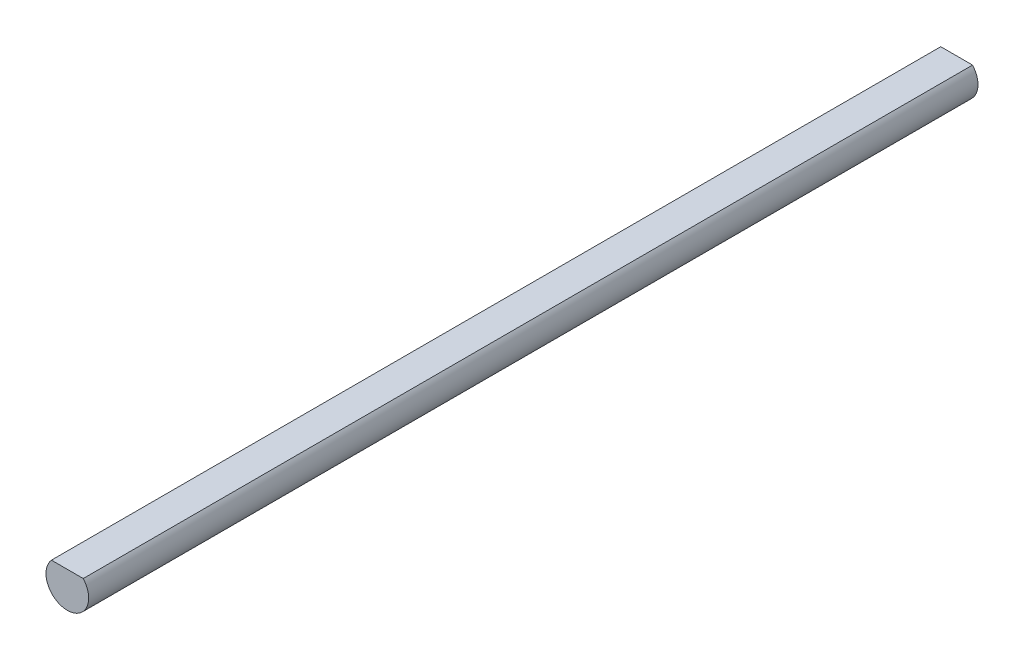
from build123d import *

# Parameters (mm, degrees)
SKETCH_1_W               = 125
SKETCH_1_H               = 3
CUT_EXTRUDE_1_DEPTH      = 63.643834493
CUT_EXTRUDE_1_DEPTH_BACK = 63.643834493
SKETCH_3_W               = 11.840495881
SKETCH_3_H               = 1.897947672


with BuildPart() as part:
    # 草圖1 → 旋轉1 (revolve)
    with BuildSketch(Plane(origin=(0, 0, 0), x_dir=(0, 0, -1), z_dir=(1, 0, 0)), mode=Mode.PRIVATE) as revolve_1_sk:
        with Locations((0, 1.5)):
            Rectangle(SKETCH_1_W, SKETCH_1_H)
    revolve(revolve_1_sk.sketch.rotate(Axis((0, 0, 62.5), (0, 0, -1)), 180), axis=Axis((0, 0, 62.5), (0, 0, -1)))

    # 草圖3 → 除料-伸長1 (cut, two sides: drawn at the far end of the back side and taken through both)
    with BuildSketch(Plane.XY.offset(-CUT_EXTRUDE_1_DEPTH_BACK)):
        with Locations((0.505798237, 2.948973836)):
            Rectangle(SKETCH_3_W, SKETCH_3_H)
    extrude(amount=CUT_EXTRUDE_1_DEPTH + CUT_EXTRUDE_1_DEPTH_BACK, mode=Mode.SUBTRACT)


solid = part.part
